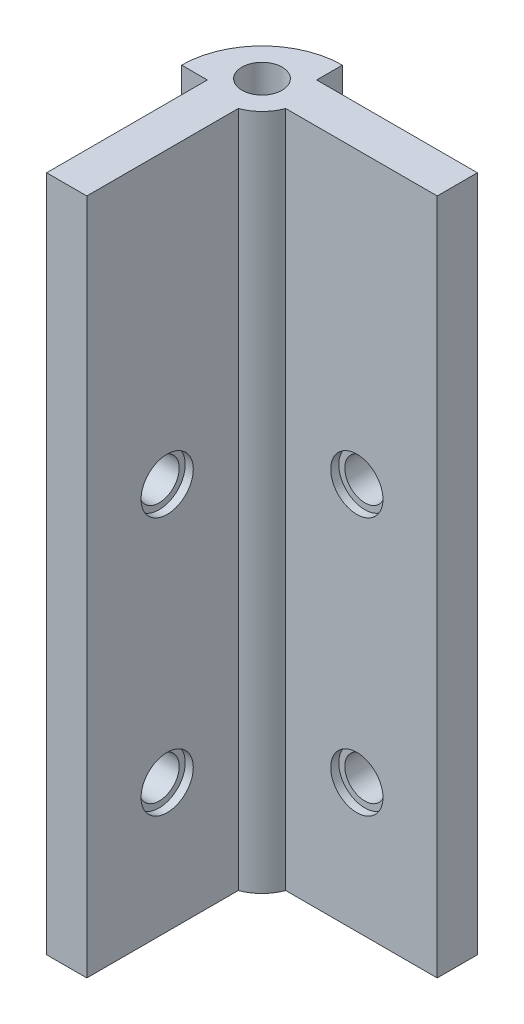
from build123d import *

# Parameters (mm, degrees)
SKETCH4_R           = 2.5
BOSS_EXTRUDE1_DEPTH = 64.27
SKETCH5_R           = 2.5
CUT_EXTRUDE1_DEPTH  = 72.548291037
SKETCH6_R           = 2.5
CUT_EXTRUDE2_DEPTH  = 74.179063133
SKETCH7_R           = 3.25
CUT_EXTRUDE3_DEPTH  = 1
SKETCH8_R           = 3.25
CUT_EXTRUDE4_DEPTH  = 1
SKETCH9_R           = 2.5
BOSS_EXTRUDE2_DEPTH = 20


with BuildPart() as part:
    # Sketch4 → Boss-Extrude1 (new body)
    with BuildSketch(Plane(origin=(0, 0, 0), x_dir=(1, 0, 0), z_dir=(0, 1, 0))):
        with BuildLine():
            Line((-5.286754077, 14.301163994), (13.559651759, 14.301163994))
            Line((13.559651759, 14.301163994), (13.559651759, 19.301163994))
            Line((13.559651759, 19.301163994), (-6.440348241, 19.301163994))
            Line((-6.440348241, 19.301163994), (-6.440348241, 22.501163994))
            ThreePointArc((-6.440348241, 22.501163994), (-13.511416053, 19.572231806), (-16.440348241, 12.501163994))
            Line((-16.440348241, 12.501163994), (-13.240348241, 12.501163994))
            Line((-13.240348241, 12.501163994), (-13.240348241, -7.498836006))
            Line((-13.240348241, -7.498836006), (-8.240348241, -7.498836006))
            Line((-8.240348241, -7.498836006), (-8.240348241, 11.347569829))
            ThreePointArc((-8.240348241, 11.347569829), (-6.440348241, 12.501163994), (-5.286754077, 14.301163994))
        make_face()
        with Locations(Location((-9.975882147, 16.0366979, 0), (0, 0, 270))):
            Circle(SKETCH4_R, mode=Mode.SUBTRACT)
    extrude(amount=BOSS_EXTRUDE1_DEPTH)

    # Sketch5 → Cut-Extrude1 (cut, through all)
    with BuildSketch(Plane(origin=(0, 0, -19.301163994), x_dir=(-1, 0, 0), z_dir=(0, 0, -1))):
        with Locations((-3.559651759, 48.2025)):
            Circle(SKETCH5_R)
        with Locations((-3.559651759, 16.0675)):
            Circle(SKETCH5_R)
    extrude(amount=-CUT_EXTRUDE1_DEPTH, mode=Mode.SUBTRACT)

    # Sketch6 → Cut-Extrude2 (cut, through all)
    with BuildSketch(Plane.ZY.offset(13.240348241)):
        with Locations((-2.501163994, 48.2025)):
            Circle(SKETCH6_R)
        with Locations((-2.501163994, 16.0675)):
            Circle(SKETCH6_R)
    extrude(amount=-CUT_EXTRUDE2_DEPTH, mode=Mode.SUBTRACT)

    # Sketch7 → Cut-Extrude3 (cut)
    with BuildSketch(Plane(origin=(-8.240348241, 0, 0), x_dir=(0, 0, -1), z_dir=(1, 0, 0))):
        with Locations((2.501163994, 48.2025)):
            Circle(SKETCH7_R)
        with Locations((2.501163994, 16.0675)):
            Circle(SKETCH7_R)
    extrude(amount=-CUT_EXTRUDE3_DEPTH, mode=Mode.SUBTRACT)

    # Sketch8 → Cut-Extrude4 (cut)
    with BuildSketch(Plane.XY.offset(-14.301163994)):
        with Locations((3.559651759, 48.2025)):
            Circle(SKETCH8_R)
        with Locations((3.559651759, 16.0675)):
            Circle(SKETCH8_R)
    extrude(amount=-CUT_EXTRUDE4_DEPTH, mode=Mode.SUBTRACT)

    # Sketch9 → Boss-Extrude2 (add)
    with BuildSketch(Plane(origin=(0, 64.27, 0), x_dir=(1, 0, 0), z_dir=(0, 1, 0))):
        with BuildLine():
            Line((-6.440348241, 22.501163994), (-6.440348241, 19.301163994))
            Line((-6.440348241, 19.301163994), (13.559651759, 19.301163994))
            Line((13.559651759, 19.301163994), (13.559651759, 14.301163994))
            Line((13.559651759, 14.301163994), (-5.286754077, 14.301163994))
            ThreePointArc((-5.286754077, 14.301163994), (-6.440348241, 12.501163994), (-8.240348241, 11.347569829))
            Line((-8.240348241, 11.347569829), (-8.240348241, -7.498836006))
            Line((-8.240348241, -7.498836006), (-13.240348241, -7.498836006))
            Line((-13.240348241, -7.498836006), (-13.240348241, 12.501163994))
            Line((-13.240348241, 12.501163994), (-16.440348241, 12.501163994))
            ThreePointArc((-16.440348241, 12.501163994), (-13.511416053, 19.572231806), (-6.440348241, 22.501163994))
        make_face()
        with Locations(Location((-9.975882147, 16.0366979, 0), (0, 0, 270))):
            Circle(SKETCH9_R, mode=Mode.SUBTRACT)
    extrude(amount=BOSS_EXTRUDE2_DEPTH)


solid = part.part
